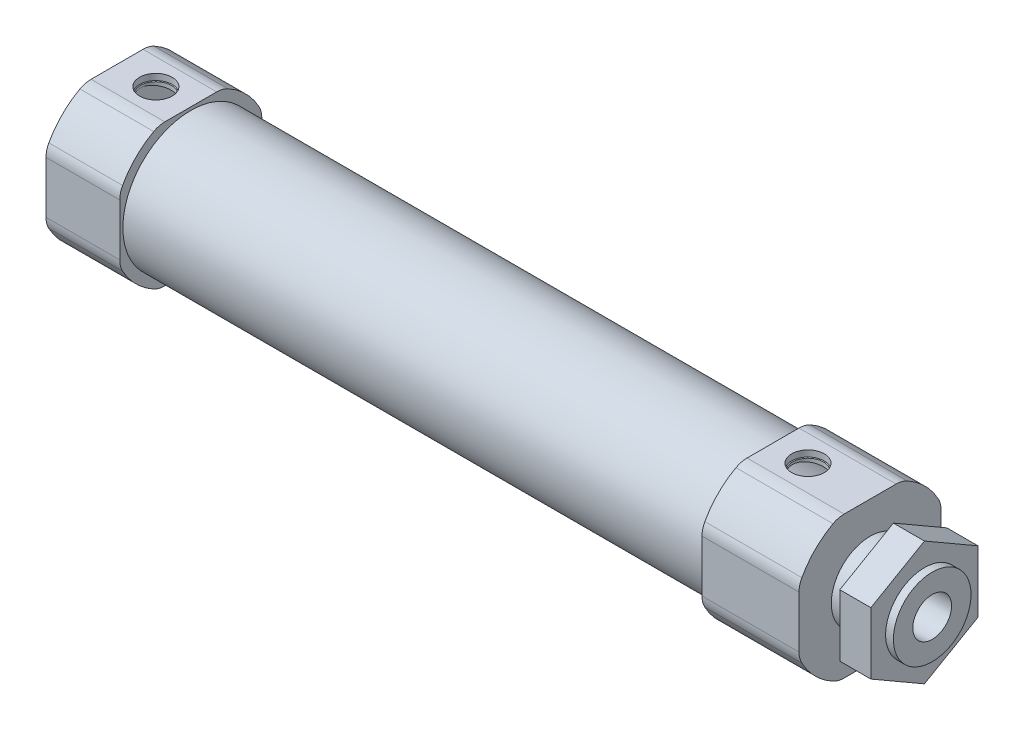
from build123d import *

# Parameters (mm, degrees)
SKETCH_482_R           = 8.75
EXTRUDE_529_DEPTH      = 97
EXTRUDE_START          = -12.5
SKETCH_1_R             = 8.75
EXTRUDE_931_DEPTH      = 12.5
SKETCH_1_2_R           = 8.75
EXTRUDE_1395_DEPTH     = 9.5
SKETCH_1_3_R           = 2
CUT_EXTRUDE_1662_DEPTH = 10
HOLE_WIZARD_1701_D     = 4.2
HOLE_WIZARD_1701_DEPTH = 0.8
HOLE_WIZARD_1701_TIP   = 1.2618073
CUT_EXTRUDE_START      = -3
SKETCH_1_4_R           = 8
CUT_EXTRUDE_3_DEPTH    = 91
SKETCH_1_5_R           = 5
EXTRUDE_2774_DEPTH     = 8
CUT_EXTRUDE_3004_REACH = 107.794
SKETCH_1_6_R           = 2.5
FILLET_2_R             = 3
FILLET_3_R             = 3
EXTRUDE_START_2        = 3
SKETCH_6_R             = 5
EXTRUDE_1_DEPTH        = 4


with BuildPart() as part:
    # Sketch 482 → Extrude 529 (new body)
    with BuildSketch(Plane(origin=(0, 0, 0), x_dir=(0, 0, -1), z_dir=(1, 0, 0))):
        with Locations(Location((0, 0, 0), (0, 0, 180))):
            Circle(SKETCH_482_R)
    extrude(amount=EXTRUDE_529_DEPTH)

    # Sketch 1 → Extrude 931 (add)
    with BuildSketch(Plane(origin=(97, 0, 0), x_dir=(0, 0, -1), z_dir=(1, 0, 0)).offset(EXTRUDE_START)):
        with BuildLine():
            Line((4.034538387, 9.15), (-4.034538387, 9.15))
            ThreePointArc((-4.034538387, 9.15), (-7.071067812, 7.071067812), (-9.15, 4.034538387))
            Line((-9.15, 4.034538387), (-9.15, -4.034538387))
            ThreePointArc((-9.15, -4.034538387), (-7.071067812, -7.071067812), (-4.034538387, -9.15))
            Line((-4.034538387, -9.15), (4.034538387, -9.15))
            ThreePointArc((4.034538387, -9.15), (7.071067812, -7.071067812), (9.15, -4.034538387))
            Line((9.15, -4.034538387), (9.15, 4.034538387))
            ThreePointArc((9.15, 4.034538387), (7.071067812, 7.071067812), (4.034538387, 9.15))
        make_face()
        with Locations(Location((0, 0, 0), (0, 0, 180))):
            Circle(SKETCH_1_R, mode=Mode.SUBTRACT)
    extrude(amount=EXTRUDE_931_DEPTH)

    # Sketch 1 2 → Extrude 1395 (add)
    with BuildSketch(Plane.ZY):
        with BuildLine():
            Line((4.034538387, 9.15), (-4.034538387, 9.15))
            ThreePointArc((-4.034538387, 9.15), (-7.071067812, 7.071067812), (-9.15, 4.034538387))
            Line((-9.15, 4.034538387), (-9.15, -4.034538387))
            ThreePointArc((-9.15, -4.034538387), (-7.071067812, -7.071067812), (-4.034538387, -9.15))
            Line((-4.034538387, -9.15), (4.034538387, -9.15))
            ThreePointArc((4.034538387, -9.15), (7.071067812, -7.071067812), (9.15, -4.034538387))
            Line((9.15, -4.034538387), (9.15, 4.034538387))
            ThreePointArc((9.15, 4.034538387), (7.071067812, 7.071067812), (4.034538387, 9.15))
        make_face()
        Circle(SKETCH_1_2_R, mode=Mode.SUBTRACT)
    extrude(amount=-EXTRUDE_1395_DEPTH)

    # Sketch 1 3 → Cut-Extrude 1662 (cut)
    with BuildSketch(Plane(origin=(0, 9.15, 0), x_dir=(1, 0, 0), z_dir=(0, 1, 0))):
        with Locations(Location((5, 0, 0), (0, 0, 270))):
            Circle(SKETCH_1_3_R)
        with Locations(Location((89, 0, 0), (0, 0, 270))):
            Circle(SKETCH_1_3_R)
    extrude(amount=-CUT_EXTRUDE_1662_DEPTH, mode=Mode.SUBTRACT)

    # Hole Wizard 1701
    with Locations(Plane(origin=(5, 9.15, 0), x_dir=(0, 0, 1), z_dir=(0, 1, 0))):
        with Locations((0, 0), (0, 84)):
            Hole(HOLE_WIZARD_1701_D / 2, depth=HOLE_WIZARD_1701_DEPTH)
            with Locations((0, 0, -(HOLE_WIZARD_1701_DEPTH + HOLE_WIZARD_1701_TIP / 2))):  # 118° drill point
                Cone(0, HOLE_WIZARD_1701_D / 2, HOLE_WIZARD_1701_TIP, mode=Mode.SUBTRACT)

    # Sketch 1 4 → 切除-拉伸3 (cut)
    with BuildSketch(Plane(origin=(97, 0, 0), x_dir=(0, 0, -1), z_dir=(1, 0, 0)).offset(CUT_EXTRUDE_START)):
        Circle(SKETCH_1_4_R)
    extrude(amount=-CUT_EXTRUDE_3_DEPTH, mode=Mode.SUBTRACT)

    # Sketch 1 5 → Extrude 2774 (add)
    with BuildSketch(Plane(origin=(97, 0, 0), x_dir=(0, 0, -1), z_dir=(1, 0, 0))):
        Circle(SKETCH_1_5_R)
    extrude(amount=EXTRUDE_2774_DEPTH)

    # Sketch 1 6 → Cut-Extrude 3004 (cut, up to next)
    with BuildSketch(Plane(origin=(105, 0, 0), x_dir=(0, 0, -1), z_dir=(1, 0, 0)), mode=Mode.PRIVATE) as cut_extrude_3004_sk1:
        Circle(SKETCH_1_6_R)
    cut_extrude_3004_tool1 = extrude(cut_extrude_3004_sk1.sketch, amount=-CUT_EXTRUDE_3004_REACH, mode=Mode.PRIVATE) & part.part
    add(cut_extrude_3004_tool1.solids().sort_by_distance((105, 0, 0))[0], mode=Mode.SUBTRACT)

    # 圆角2
    fillet_2_edges = [part.edges().sort_by_distance(p)[0] for p in [
        (4.75, 4.034538387, 9.15),
        (4.75, -4.034538387, 9.15),
        (4.75, -9.15, 4.034538387),
        (4.75, -9.15, -4.034538387),
        (4.75, -4.034538387, -9.15),
        (4.75, 4.034538387, -9.15),
        (4.75, 9.15, -4.034538387),
        (4.75, 9.15, 4.034538387),
    ]]
    fillet(fillet_2_edges, radius=FILLET_2_R)

    # 圆角3
    fillet_3_edges = [part.edges().sort_by_distance(p)[0] for p in [
        (90.75, 4.034538387, -9.15),
        (90.75, -4.034538387, -9.15),
        (90.75, -9.15, -4.034538387),
        (90.75, -9.15, 4.034538387),
        (90.75, -4.034538387, 9.15),
        (90.75, 4.034538387, 9.15),
        (90.75, 9.15, 4.034538387),
        (90.75, 9.15, -4.034538387),
    ]]
    fillet(fillet_3_edges, radius=FILLET_3_R)


with BuildPart() as body_2:
    # 草图6 → 凸台-拉伸1 (new body)
    with BuildSketch(Plane(origin=(97, 0, 0), x_dir=(0, 0, -1), z_dir=(1, 0, 0)).offset(EXTRUDE_START_2)):
        Polygon((0, -7.967433715), (6.9, -3.983716857), (6.9, 3.983716857), (0, 7.967433715), (-6.9, 3.983716857), (-6.9, -3.983716857), align=None)
        Circle(SKETCH_6_R, mode=Mode.SUBTRACT)
    extrude(amount=EXTRUDE_1_DEPTH)


solid = Compound([part.part, body_2.part])
